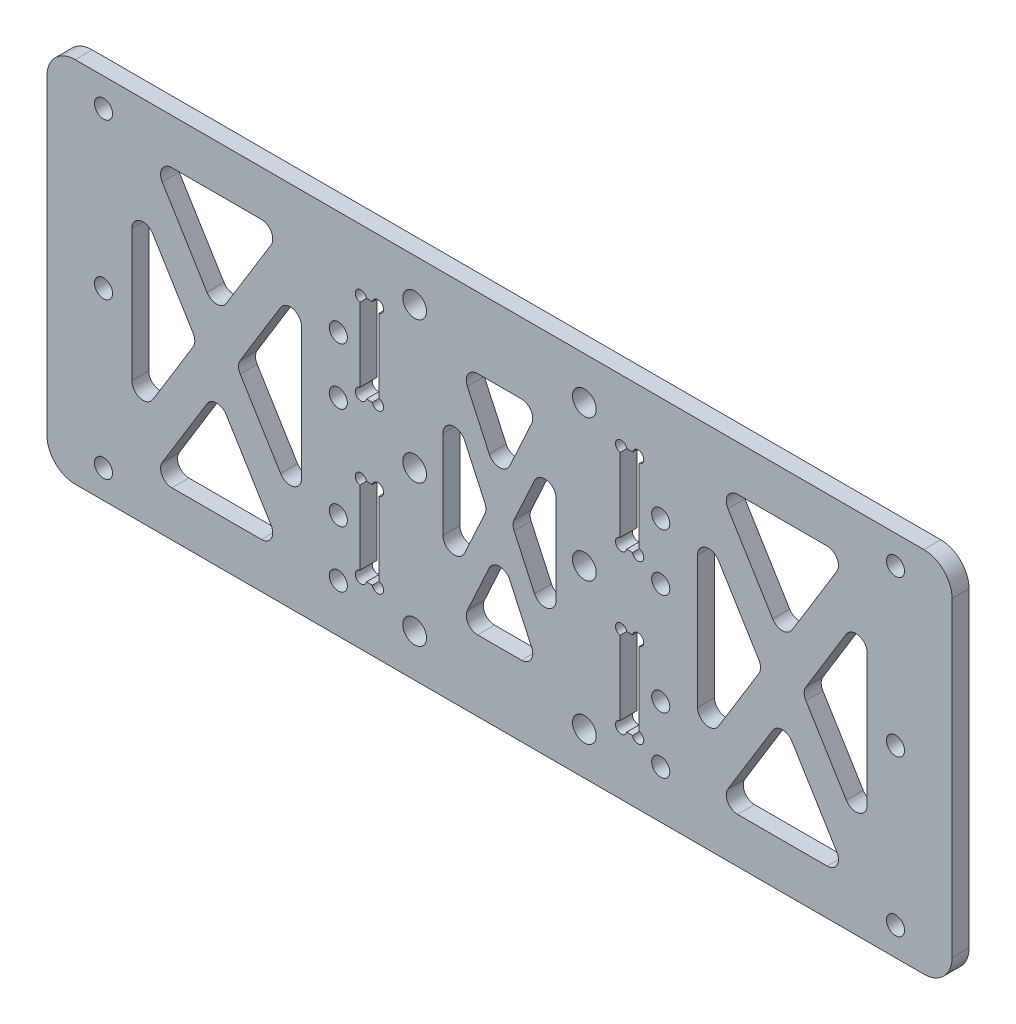
from build123d import *

# Parameters (mm, degrees)
SKETCH_1_W          = 160
SKETCH_1_H          = 65
EXTRUDE_1_DEPTH     = 3
SKETCH_2_R          = 1.6
CUT_EXTRUDE_1_DEPTH = 173.725215299
SKETCH_3_R          = 2.1
CUT_EXTRUDE_2_DEPTH = 173.725215299
SKETCH_4_W          = 3
SKETCH_4_H          = 15
CUT_EXTRUDE_3_DEPTH = 173.725215299
SKETCH_5_R          = 1
CUT_EXTRUDE_4_DEPTH = 173.725215299
FILLET_1_R          = 5
SKETCH_6_R          = 1.6
CUT_EXTRUDE_5_DEPTH = 10
SKETCH_7_W          = 30
SKETCH_7_H          = 49
CUT_EXTRUDE_6_DEPTH = 10
SKETCH_8_W          = 20
SKETCH_8_H          = 40
CUT_EXTRUDE_7_DEPTH = 10
EXTRUDE_2_DEPTH     = 3
FILLET_3_R          = 2
SKETCH_10_W         = 3.4
SKETCH_10_H         = 15.4
CUT_EXTRUDE_8_DEPTH = 173.725215299


with BuildPart() as part:
    # 草图1 → 凸台-拉伸1 (new body)
    with BuildSketch(Plane.XY):
        with Locations((80, 32.5)):
            Rectangle(SKETCH_1_W, SKETCH_1_H)
    extrude(amount=EXTRUDE_1_DEPTH)

    # 草图2 → 切除-拉伸1 (cut, through all)
    with BuildSketch(Plane.XY.offset(3)):
        with Locations((150, 60)):
            Circle(SKETCH_2_R)
        with Locations((150, 32.5)):
            Circle(SKETCH_2_R)
        with Locations((150, 5)):
            Circle(SKETCH_2_R)
        with Locations(Location((10, 5, 0), (0, 0, 180))):
            Circle(SKETCH_2_R)
        with Locations(Location((10, 32.5, 0), (0, 0, 180))):
            Circle(SKETCH_2_R)
        with Locations(Location((10, 60, 0), (0, 0, 180))):
            Circle(SKETCH_2_R)
    extrude(amount=-CUT_EXTRUDE_1_DEPTH, mode=Mode.SUBTRACT)

    # 草图3 → 切除-拉伸2 (cut, through all)
    with BuildSketch(Plane.XY.offset(3)):
        with Locations((65, 57.5)):
            Circle(SKETCH_3_R)
        with Locations((65, 32.5)):
            Circle(SKETCH_3_R)
        with Locations(Location((65, 7.5, 0), (0, 0, 180))):
            Circle(SKETCH_3_R)
        with Locations((95, 7.5)):
            Circle(SKETCH_3_R)
        with Locations(Location((95, 32.5, 0), (0, 0, 180))):
            Circle(SKETCH_3_R)
        with Locations(Location((95, 57.5, 0), (0, 0, 180))):
            Circle(SKETCH_3_R)
    extrude(amount=-CUT_EXTRUDE_2_DEPTH, mode=Mode.SUBTRACT)

    # 草图4 → 切除-拉伸3 (cut, through all)
    with BuildSketch(Plane.XY.offset(3)):
        with Locations((57, 46.5)):
            Rectangle(SKETCH_4_W, SKETCH_4_H)
        with Locations((57, 18.5)):
            Rectangle(SKETCH_4_W, SKETCH_4_H)
        with Locations((103, 18.5)):
            Rectangle(SKETCH_4_W, SKETCH_4_H)
        with Locations((103, 46.5)):
            Rectangle(SKETCH_4_W, SKETCH_4_H)
    extrude(amount=-CUT_EXTRUDE_3_DEPTH, mode=Mode.SUBTRACT)

    # 草图5 → 切除-拉伸4 (cut, through all)
    with BuildSketch(Plane.XY.offset(3)):
        with Locations((58.5, 54)):
            Circle(SKETCH_5_R)
        with Locations((55.5, 54)):
            Circle(SKETCH_5_R)
        with Locations((58.5, 39)):
            Circle(SKETCH_5_R)
        with Locations((55.5, 39)):
            Circle(SKETCH_5_R)
        with Locations((58.5, 26)):
            Circle(SKETCH_5_R)
        with Locations((55.5, 26)):
            Circle(SKETCH_5_R)
        with Locations((58.5, 11)):
            Circle(SKETCH_5_R)
        with Locations((55.5, 11)):
            Circle(SKETCH_5_R)
        with Locations((104.5, 54)):
            Circle(SKETCH_5_R)
        with Locations((101.5, 54)):
            Circle(SKETCH_5_R)
        with Locations((104.5, 39)):
            Circle(SKETCH_5_R)
        with Locations((101.5, 39)):
            Circle(SKETCH_5_R)
        with Locations((104.5, 26)):
            Circle(SKETCH_5_R)
        with Locations((101.5, 26)):
            Circle(SKETCH_5_R)
        with Locations((104.5, 11)):
            Circle(SKETCH_5_R)
        with Locations((101.5, 11)):
            Circle(SKETCH_5_R)
    extrude(amount=-CUT_EXTRUDE_4_DEPTH, mode=Mode.SUBTRACT)

    # 圆角1
    fillet_1_edges = [part.edges().sort_by_distance(p)[0] for p in [
        (0, 65, 1.5),
        (160, 65, 1.5),
        (160, 0, 1.5),
        (0, 0, 1.5),
    ]]
    fillet(fillet_1_edges, radius=FILLET_1_R)

    # 草图6 → 切除-拉伸5 (cut)
    with BuildSketch(Plane.XY.offset(3)):
        with Locations((108.5, 46.5)):
            Circle(SKETCH_6_R)
        with Locations((108.5, 36.5)):
            Circle(SKETCH_6_R)
        with Locations((108.5, 18.5)):
            Circle(SKETCH_6_R)
        with Locations((108.5, 8.5)):
            Circle(SKETCH_6_R)
        with Locations(Location((51.5, 8.5, 0), (0, 0, 180))):
            Circle(SKETCH_6_R)
        with Locations(Location((51.5, 18.5, 0), (0, 0, 180))):
            Circle(SKETCH_6_R)
        with Locations(Location((51.5, 36.5, 0), (0, 0, 180))):
            Circle(SKETCH_6_R)
        with Locations(Location((51.5, 46.5, 0), (0, 0, 180))):
            Circle(SKETCH_6_R)
    extrude(amount=-CUT_EXTRUDE_5_DEPTH, mode=Mode.SUBTRACT)

    # 草图7 → 切除-拉伸6 (cut)
    with BuildSketch(Plane.XY.offset(3)):
        with Locations((130, 32.5)):
            Rectangle(SKETCH_7_W, SKETCH_7_H)
        with Locations((30, 32.5)):
            Rectangle(SKETCH_7_W, SKETCH_7_H)
    extrude(amount=-CUT_EXTRUDE_6_DEPTH, mode=Mode.SUBTRACT)

    # 草图8 → 切除-拉伸7 (cut)
    with BuildSketch(Plane.XY.offset(3)):
        with Locations((80, 32.5)):
            Rectangle(SKETCH_8_W, SKETCH_8_H)
    extrude(amount=-CUT_EXTRUDE_7_DEPTH, mode=Mode.SUBTRACT)

    # 草图9 → 凸台-拉伸2 (add, through all)
    with BuildSketch(Plane.XY.offset(3)):
        Polygon((45, 13.745432969), (45, 8), (41.482387978, 8), (30, 26.754567031), (18.517612022, 8), (15, 8), (15, 13.745432969), (26.482387978, 32.5), (15, 51.254567031), (15, 57), (18.517612022, 57), (30, 38.245432969), (41.482387978, 57), (45, 57), (45, 51.254567031), (33.517612022, 32.5), align=None)
        Polygon((82.201517486, 32.5), (90, 15.549573016), (90, 12.5), (87, 12.5), (80, 27.714881699), (73, 12.5), (70, 12.5), (70, 15.549573016), (77.798482514, 32.5), (70, 49.450426984), (70, 52.5), (73, 52.5), (80, 37.285118301), (87, 52.5), (90, 52.5), (90, 49.450426984), align=None)
        Polygon((130, 26.754567031), (118.517612022, 8), (115, 8), (115, 13.745432969), (126.482387978, 32.5), (115, 51.254567031), (115, 57), (118.517612022, 57), (130, 38.245432969), (141.482387978, 57), (145, 57), (145, 51.254567031), (133.517612022, 32.5), (145, 13.745432969), (145, 8), (141.482387978, 8), align=None)
    extrude(amount=-EXTRUDE_2_DEPTH)

    # 圆角3
    fillet_3_edges = [part.edges().sort_by_distance(p)[0] for p in [
        (45, 13.745432969, 1.5),
        (41.482387978, 8, 1.5),
        (30, 26.754567031, 1.5),
        (18.517612022, 8, 1.5),
        (15, 13.745432969, 1.5),
        (26.482387978, 32.5, 1.5),
        (15, 51.254567031, 1.5),
        (18.517612022, 57, 1.5),
        (30, 38.245432969, 1.5),
        (41.482387978, 57, 1.5),
        (45, 51.254567031, 1.5),
        (33.517612022, 32.5, 1.5),
        (82.201517486, 32.5, 1.5),
        (90, 15.549573016, 1.5),
        (87, 12.5, 1.5),
        (80, 27.714881699, 1.5),
        (73, 12.5, 1.5),
        (70, 15.549573016, 1.5),
        (77.798482514, 32.5, 1.5),
        (70, 49.450426984, 1.5),
        (73, 52.5, 1.5),
        (80, 37.285118301, 1.5),
        (87, 52.5, 1.5),
        (90, 49.450426984, 1.5),
        (130, 26.754567031, 1.5),
        (118.517612022, 8, 1.5),
        (115, 13.745432969, 1.5),
        (126.482387978, 32.5, 1.5),
        (115, 51.254567031, 1.5),
        (118.517612022, 57, 1.5),
        (130, 38.245432969, 1.5),
        (141.482387978, 57, 1.5),
        (145, 51.254567031, 1.5),
        (133.517612022, 32.5, 1.5),
        (145, 13.745432969, 1.5),
        (141.482387978, 8, 1.5),
    ]]
    fillet(fillet_3_edges, radius=FILLET_3_R)

    # 草图10 → 切除-拉伸8 (cut, through all)
    with BuildSketch(Plane.XY.offset(3)):
        with Locations((103, 46.5)):
            Rectangle(SKETCH_10_W, SKETCH_10_H)
        with Locations((103, 18.5)):
            Rectangle(SKETCH_10_W, SKETCH_10_H)
        with Locations((57, 18.5)):
            Rectangle(SKETCH_10_W, SKETCH_10_H)
        with Locations((57, 46.5)):
            Rectangle(SKETCH_10_W, SKETCH_10_H)
    extrude(amount=-CUT_EXTRUDE_8_DEPTH, mode=Mode.SUBTRACT)


solid = part.part
